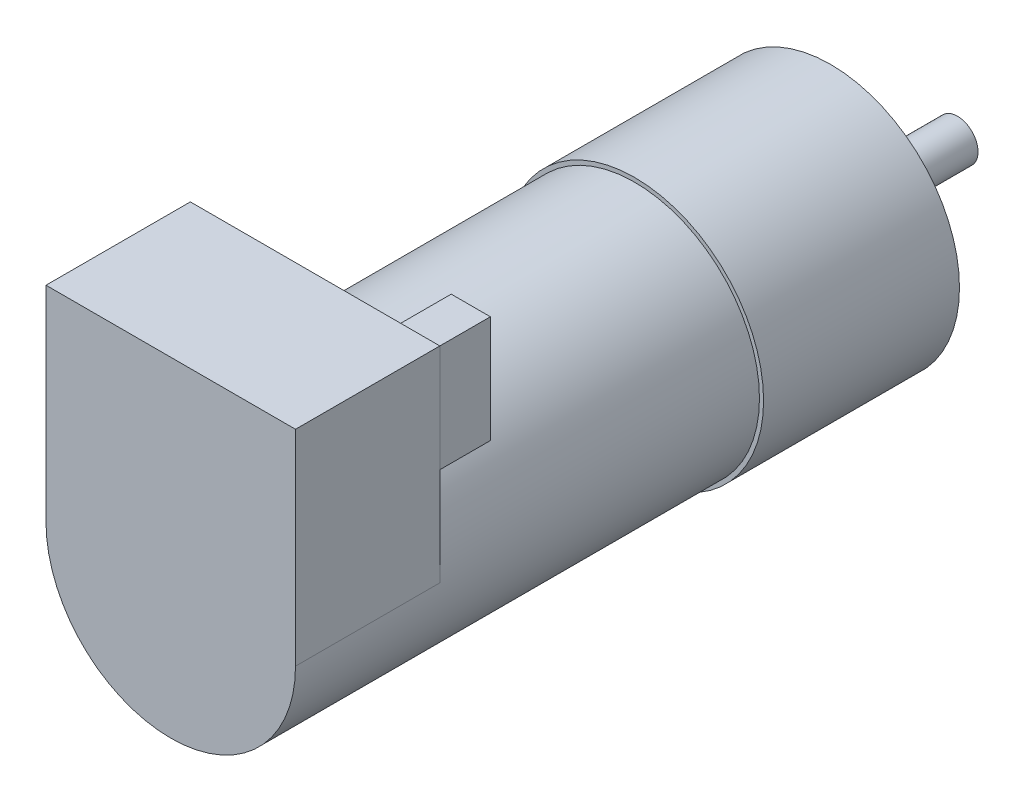
from build123d import *

# Parameters (mm, degrees)
SKETCH1_R           = 12.5
BOSS_EXTRUDE1_DEPTH = 19
SKETCH2_R           = 12.1
BOSS_EXTRUDE2_DEPTH = 31
BOSS_EXTRUDE3_DEPTH = 14
SKETCH4_W           = 3.8
SKETCH4_H           = 10.4
BOSS_EXTRUDE4_DEPTH = 5
SKETCH5_R           = 3.5
BOSS_EXTRUDE5_DEPTH = 2.7
SKETCH6_R           = 2
BOSS_EXTRUDE6_DEPTH = 12.3
SKETCH7_R           = 1.5
CUT_EXTRUDE1_DEPTH  = 5


with BuildPart() as part:
    # Sketch1 → Boss-Extrude1 (new body)
    with BuildSketch(Plane.XY):
        Circle(SKETCH1_R)
    extrude(amount=BOSS_EXTRUDE1_DEPTH)

    # Sketch2 → Boss-Extrude2 (add)
    with BuildSketch(Plane.XY.offset(19)):
        Circle(SKETCH2_R)
    extrude(amount=BOSS_EXTRUDE2_DEPTH)

    # Sketch3 → Boss-Extrude3 (add)
    with BuildSketch(Plane.XY.offset(50)):
        with BuildLine():
            Line((-12.1, 0), (-12.1, 19.9))
            Line((-12.1, 19.9), (12.1, 19.9))
            Line((12.1, 19.9), (12.1, 0))
            ThreePointArc((12.1, 0), (0, -12.1), (-12.1, 0))
        make_face()
    extrude(amount=BOSS_EXTRUDE3_DEPTH)

    # Sketch4 → Boss-Extrude4 (add)
    with BuildSketch(Plane(origin=(0, 0, 50), x_dir=(-1, 0, 0), z_dir=(0, 0, -1))):
        with Locations((-10.1, 14.6)):
            Rectangle(SKETCH4_W, SKETCH4_H)
    extrude(amount=BOSS_EXTRUDE4_DEPTH)

    # Sketch5 → Boss-Extrude5 (add)
    with BuildSketch(Plane(origin=(0, 0, 0), x_dir=(-1, 0, 0), z_dir=(0, 0, -1))):
        with Locations(Location((0, 0, 0), (0, 0, 180))):
            Circle(SKETCH5_R)
    extrude(amount=BOSS_EXTRUDE5_DEPTH)

    # Sketch6 → Boss-Extrude6 (add)
    with BuildSketch(Plane(origin=(0, 0, 0), x_dir=(-1, 0, 0), z_dir=(0, 0, -1))):
        Circle(SKETCH6_R)
    extrude(amount=BOSS_EXTRUDE6_DEPTH)

    # Sketch7 → Cut-Extrude1 (cut)
    with BuildSketch(Plane(origin=(0, 0, 0), x_dir=(-1, 0, 0), z_dir=(0, 0, -1))):
        with Locations((6.01040764, 6.01040764)):
            Circle(SKETCH7_R)
        with Locations((-6.01040764, -6.01040764)):
            Circle(SKETCH7_R)
    extrude(amount=-CUT_EXTRUDE1_DEPTH, mode=Mode.SUBTRACT)


solid = part.part
